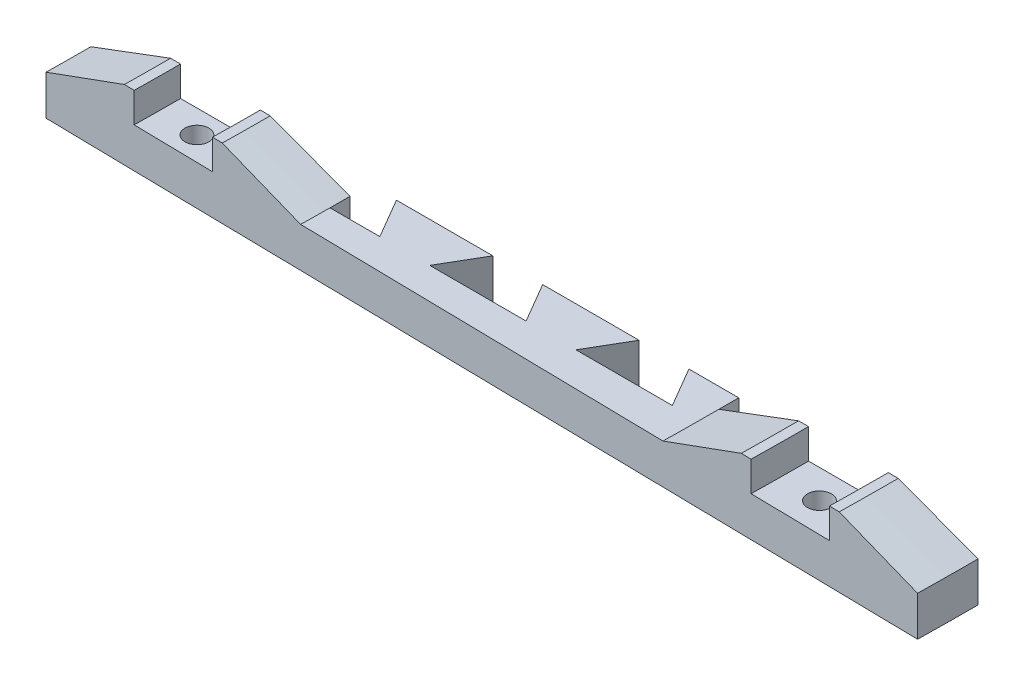
from build123d import *

# Parameters (mm, degrees)
EXTRUDE_1_DEPTH          = 2.5
SKETCH_5_R               = 0.6
CUT_EXTRUDE_1_DEPTH      = 19.036421485
CUT_EXTRUDE_START        = -2
SKETCH_5_3_R             = 1
CUT_EXTRUDE_2_DEPTH      = 1
REVOLVE_1_ANGLE          = 1
SKETCH_9_R               = 0.6
CUT_EXTRUDE_3_DEPTH      = 41.426698916
SKETCH_9_3_R             = 1
CUT_EXTRUDE_4_DEPTH      = 1
CUT_EXTRUDE_9_DEPTH      = 41.426698916
CUT_EXTRUDE_9_DEPTH_BACK = 41.426698916


with BuildPart() as part:
    # 草图4 → 凸台-拉伸1 (new body)
    with BuildSketch(Plane.XY):
        Polygon((8.5, -1.5), (17.75, -1.5), (17.75, -3.5), (-4.5, -3.5), (-4.5, -1.5), (-0.5, 0), (0, 0), (0, -1.5), (4, -1.5), (4, 0), (4.5, 0), align=None)
    extrude(amount=EXTRUDE_1_DEPTH)

    # 草图5 → 切除-拉伸1 (cut, through all)
    with BuildSketch(Plane(origin=(0, -1.5, 0), x_dir=(1, 0, 0), z_dir=(0, 1, 0))):
        with Locations(Location((2, -1.25, 0), (0, 0, 270))):
            Circle(SKETCH_5_R)
    extrude(amount=-CUT_EXTRUDE_1_DEPTH, mode=Mode.SUBTRACT)

    # 草图5<3> → 切除-拉伸2 (cut)
    with BuildSketch(Plane(origin=(0, -1.5, 0), x_dir=(1, 0, 0), z_dir=(0, 1, 0)).offset(CUT_EXTRUDE_START)):
        with Locations((2, -1.25)):
            Circle(SKETCH_5_3_R)
    extrude(amount=CUT_EXTRUDE_2_DEPTH, mode=Mode.SUBTRACT)

    # 镜向1: part across plane


with BuildPart() as part_1:
    add(part.part)
    add(part.part.mirror(Plane(origin=(17.75, 0, 2.5), x_dir=(0, 0, 1), z_dir=(1, 0, 0))))

    # 草图6 → 旋转1 (revolve)
    with BuildSketch(Plane.XY.offset(2.5)):
        Polygon((0, 0), (-0.5, 0), (-4.5, -1.5), (-4.5, -3.5), (40, -3.5), (40, -1.5), (36, 0), (35.5, 0), (35.5, -1.5), (31.5, -1.5), (31.5, 0), (31, 0), (27, -1.5), (8.5, -1.5), (4.5, 0), (4, 0), (4, -1.5), (0, -1.5), align=None)
    revolve(axis=Axis((-132.25, 94.8535776, 2.5), (0, -1, 0)), revolution_arc=REVOLVE_1_ANGLE)

    # 草图9 → 切除-拉伸3 (cut, through all)
    with BuildSketch(Plane(origin=(0, -1.5, 0), x_dir=(1, 0, 0), z_dir=(0, 1, 0))):
        with Locations(Location((1.994888171, -3.671537391, 0), (0, 0, 180))):
            Circle(SKETCH_9_R)
        with Locations(Location((33.493688748, -3.946423259, 0), (0, 0, 180))):
            Circle(SKETCH_9_R)
    extrude(amount=-CUT_EXTRUDE_3_DEPTH, mode=Mode.SUBTRACT)

    # 草图9<3> → 切除-拉伸4 (cut)
    with BuildSketch(Plane(origin=(0, -1.5, 0), x_dir=(1, 0, 0), z_dir=(0, 1, 0)).offset(CUT_EXTRUDE_START)):
        with Locations((1.994888171, -3.671537391)):
            Circle(SKETCH_9_3_R)
        with Locations((33.493688748, -3.946423259)):
            Circle(SKETCH_9_3_R)
    extrude(amount=CUT_EXTRUDE_4_DEPTH, mode=Mode.SUBTRACT)

    # 草图10 → 切除-拉伸9 (cut, two sides: drawn at the far end of the back side and taken through both)
    with BuildSketch(Plane(origin=(0, -1.5, 0), x_dir=(1, 0, 0), z_dir=(0, 1, 0)).offset(-CUT_EXTRUDE_9_DEPTH_BACK)):
        Polygon((27, -2.5), (27, -1.5), (24.5, -1.5), (25.667850814, -3.5), (20.832149186, -3.5), (22, -1.5), (17.164298372, -1.5), (18.332149186, -3.5), (13.496447557, -3.5), (14.664298372, -1.5), (9.828596743, -1.5), (10.996447557, -3.5), (8.496447557, -3.5), (8.5, -2.5), (-4.5, -2.5), (-4.5, 0), (40, 0), (40, -2.5), align=None)
    extrude(amount=CUT_EXTRUDE_9_DEPTH + CUT_EXTRUDE_9_DEPTH_BACK, mode=Mode.SUBTRACT)


solid = part_1.part
